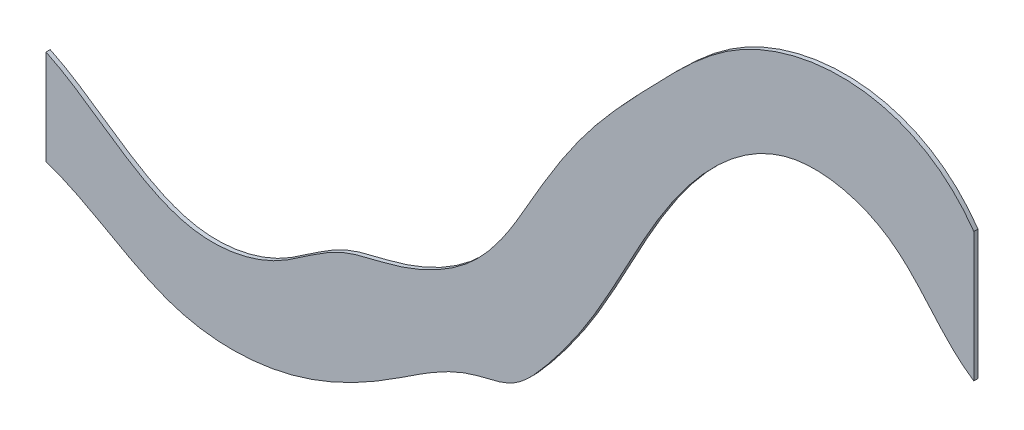
from build123d import *

# Parameters (mm, degrees)
BOSS_EXTRUDE1_DEPTH = 0.45
SCALE2_SCALE        = 7


with BuildPart() as part:
    # Sketch1 → Boss-Extrude1 (new body)
    with BuildSketch(Plane.XY):
        with BuildLine():
            Line((0, 7.874015808), (0, 18.110237122))
            add(Edge.make_bspline(
                [(0, 18.110237122), (5.197250837, 15.681070622), (12.501216503, 7.744855261), (25.097876962, 10.232630048), (30.831117735, 15.646786773), (38.839584006, 16.923397014), (47.530018638, 21.437168604), (52.595075133, 31.301954435), (58.535631865, 40.527401216), (65.917966651, 48.233777596), (77.681512051, 60.27017899), (93.834912938, 60.224267729), (100, 51.360058337)],
                knots=[0, 0, 0, 0, 0.148941706, 0.220351634, 0.287719618, 0.334218391, 0.414248514, 0.515237394, 0.595838964, 0.681768577, 0.77460146, 1, 1, 1, 1], degree=3))
            Line((100, 51.360058337), (100, 37.401573181))
            add(Edge.make_bspline(
                [(0, 7.874015808), (4.944591816, 6.243851617), (10.475763732, 1.560198012), (19.800962139, 0.078437915), (28.045639535, 1.023070952), (36.905378333, 5.624841864), (44.002324621, 10.933951141), (50.422695685, 11.835006862), (54.554582877, 16.369202077), (59.475154106, 23.228178272), (64.143527908, 32.715034775), (70.259683215, 42.449409973), (79.649884648, 50.146347234), (92.682596164, 46.948861272), (96.446080944, 39.713208535), (100, 37.401573181)],
                knots=[0, 0, 0, 0, 0.124881401, 0.163041618, 0.22296914, 0.319802796, 0.398409543, 0.431158174, 0.468929657, 0.538576812, 0.635461275, 0.718983693, 0.816425112, 0.900124054, 1, 1, 1, 1], degree=3))
        make_face()
    extrude(amount=BOSS_EXTRUDE1_DEPTH)


with BuildPart() as part_1:
    # Scale2: scaled about (0, 0, 0)
    add(part.part.scale(SCALE2_SCALE))


solid = part_1.part
